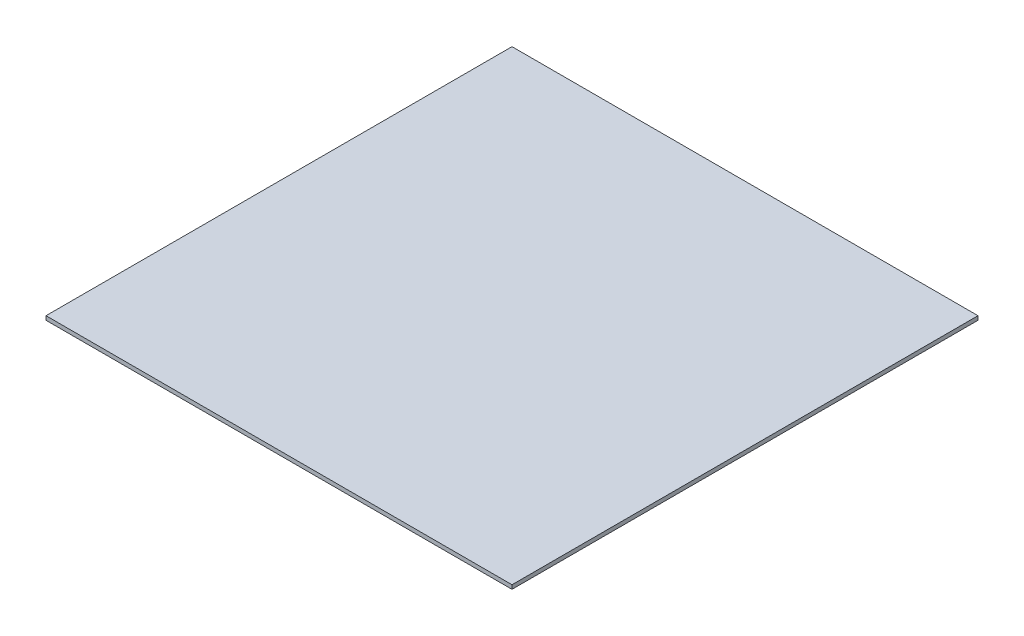
from build123d import *

# Parameters (mm, degrees)
ESQUISSE1_W        = 350
ESQUISSE1_H        = 350
BOSS_EXTRU_1_DEPTH = 3


with BuildPart() as part:
    # Esquisse1 → Boss.-Extru.1 (new body)
    with BuildSketch(Plane(origin=(0, 0, 0), x_dir=(1, 0, 0), z_dir=(0, 1, 0))):
        Rectangle(ESQUISSE1_W, ESQUISSE1_H)
    extrude(amount=BOSS_EXTRU_1_DEPTH)


solid = part.part
